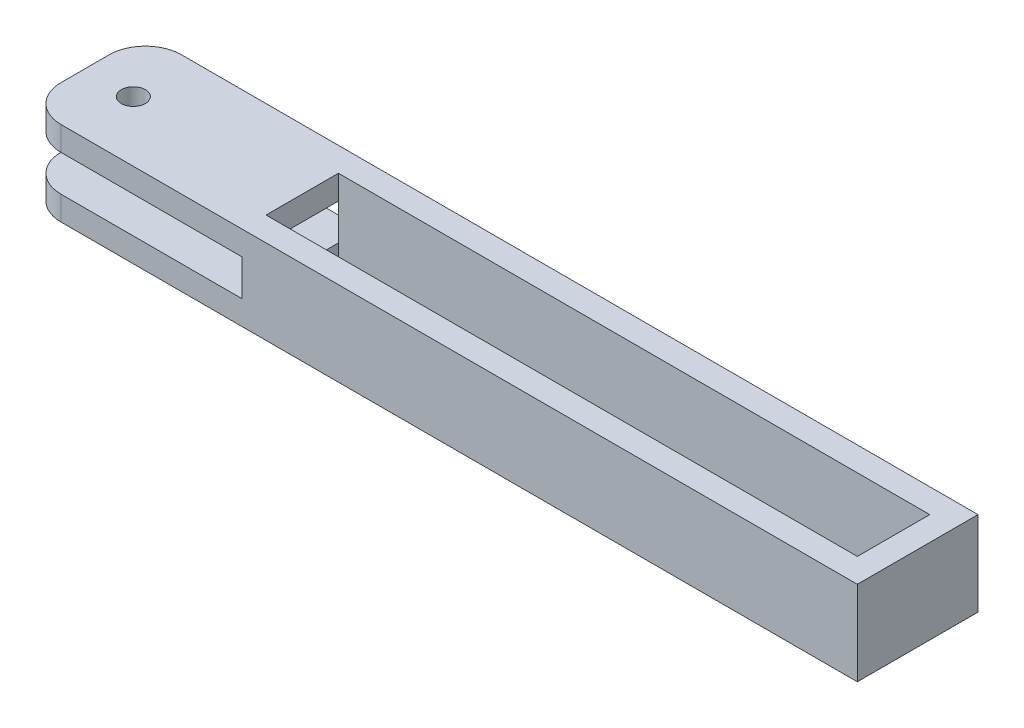
from build123d import *

# Parameters (mm, degrees)
BOSS_EXTRUDE1_DEPTH = 50
SKETCH2_R           = 5
SKETCH2_W           = 245
SKETCH2_H           = 30
CUT_EXTRUDE1_DEPTH  = 351.356960827
FILLET1_R           = 15


with BuildPart() as part:
    # Sketch1 → Boss-Extrude1 (new body)
    with BuildSketch(Plane.XY):
        Polygon((-345, 25), (-255, 25), (-255, 10), (-345, 10), (-345, 0), (0, 0), (0, 35), (-345, 35), align=None)
    extrude(amount=BOSS_EXTRUDE1_DEPTH)

    # Sketch2 → Cut-Extrude1 (cut, through all)
    with BuildSketch(Plane(origin=(0, 35, 0), x_dir=(1, 0, 0), z_dir=(0, 1, 0))):
        with Locations(Location((-325, -25, 0), (0, 0, 180))):
            Circle(SKETCH2_R)
        with Locations((-132.5, -25)):
            Rectangle(SKETCH2_W, SKETCH2_H)
    extrude(amount=-CUT_EXTRUDE1_DEPTH, mode=Mode.SUBTRACT)

    # Fillet1
    fillet1_edges = [part.edges().sort_by_distance(p)[0] for p in [
        (-345, 30, 0),
        (-345, 30, 50),
        (-345, 5, 50),
        (-345, 5, 0),
    ]]
    fillet(fillet1_edges, radius=FILLET1_R)


solid = part.part
